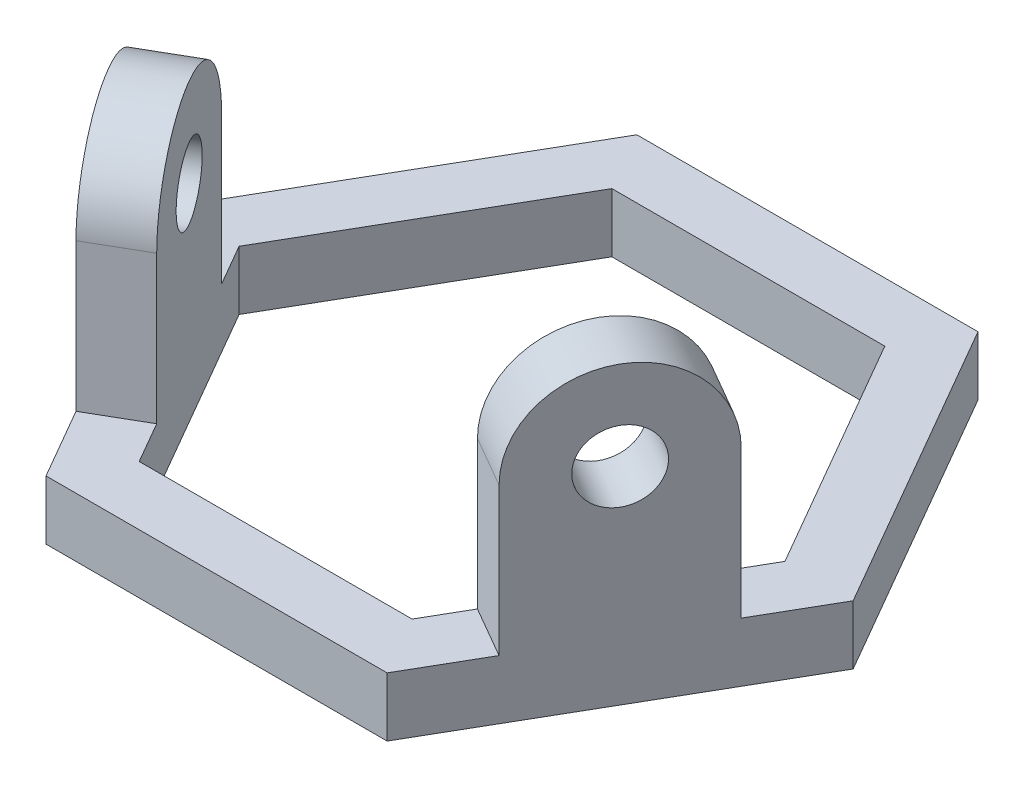
from build123d import *

# Parameters (mm, degrees)
BOSS_EXTRUDE1_DEPTH = 10
SKETCH2_R           = 6
BOSS_EXTRUDE2_DEPTH = 10


with BuildPart() as part:
    # Sketch1 → Boss-Extrude1 (new body)
    with BuildSketch(Plane(origin=(0, 0, 0), x_dir=(1, 0, 0), z_dir=(0, 1, 0))):
        Polygon((57.735026919, 0), (28.867513459, 50), (-28.867513459, 50), (-57.735026919, 0), (-28.867513459, -50), (28.867513459, -50), align=None)
        Polygon((23.094010768, 40), (-23.094010768, 40), (-46.188021535, 0), (-23.094010768, -40), (23.094010768, -40), (46.188021535, 0), align=None, mode=Mode.SUBTRACT)
    extrude(amount=BOSS_EXTRUDE1_DEPTH)

    # Sketch2 → Boss-Extrude2 (add)
    with BuildSketch(Plane(origin=(43.301270189, 0, 25), x_dir=(0.4999999999999951, 0, -0.8660254037844415), z_dir=(0.8660254037844416, 0, 0.49999999999999517))):
        with BuildLine():
            Line((-15, 35), (-15, 10))
            Line((-15, 10), (15, 10))
            Line((15, 10), (15, 35))
            ThreePointArc((15, 35), (0, 50), (-15, 35))
        make_face()
        with Locations((0, 35)):
            Circle(SKETCH2_R, mode=Mode.SUBTRACT)
    boss_extrude2 = extrude(amount=-BOSS_EXTRUDE2_DEPTH)

    # Mirror7: Boss-Extrude2 across plane
    add(boss_extrude2.mirror(Plane(origin=(0, 0, 0), x_dir=(0, 0, 1), z_dir=(1, 0, 0))))


solid = part.part
